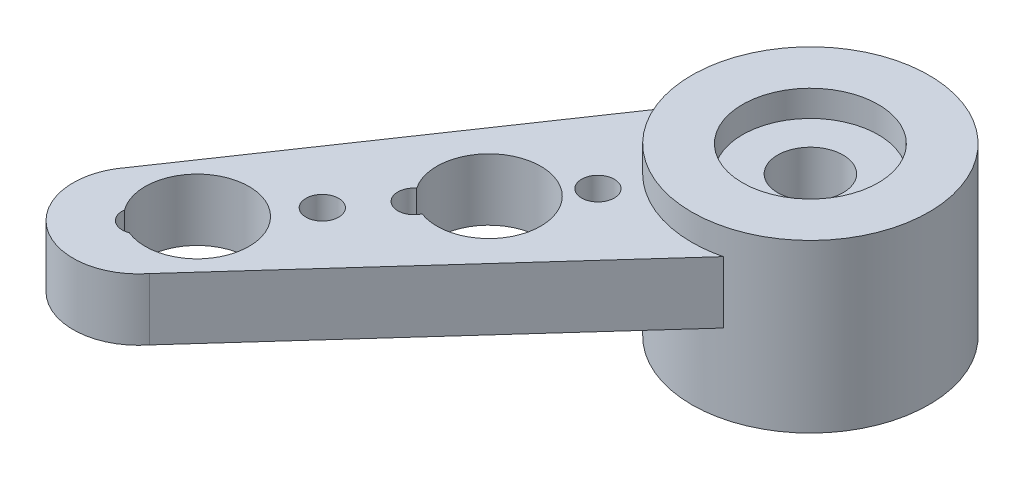
from build123d import *

# Parameters (mm, degrees)
SKETCH1_R           = 3.625
SKETCH1_R_2         = 2.075
BOSS_EXTRUDE1_DEPTH = 2.41
SKETCH2_R           = 1
SKETCH2_R_2         = 0.5
BOSS_EXTRUDE3_DEPTH = 1.89
BOSS_EXTRUDE4_START = 4.3
SKETCH1_2_R         = 3.625
SKETCH1_2_R_2       = 2.075
BOSS_EXTRUDE4_DEPTH = 0.8
SKETCH3_R           = 1.5875
CUT_EXTRUDE1_DEPTH  = 18.958844524


with BuildPart() as part:
    # Sketch1 → Boss-Extrude1 (new body)
    with BuildSketch(Plane(origin=(0, 0, 0), x_dir=(1, 0, 0), z_dir=(0, 1, 0))):
        with Locations(Location((0, 0, 0), (0, 0, 270))):
            Circle(SKETCH1_R)
        with Locations(Location((0, 0, 0), (0, 0, 270))):
            Circle(SKETCH1_R_2, mode=Mode.SUBTRACT)
    extrude(amount=BOSS_EXTRUDE1_DEPTH)

    # Sketch2 → Boss-Extrude3 (add)
    with BuildSketch(Plane(origin=(0, 2.41, 0), x_dir=(1, 0, 0), z_dir=(0, 1, 0))):
        with BuildLine():
            Line((-10.6054557, -10.267177528), (-3.625, 0))
            ThreePointArc((-3.625, 0), (2.238819707, 2.851019347), (0.859585555, -3.521610097))
            Line((0.859585555, -3.521610097), (-7.459503317, -12.737599274))
            ThreePointArc((-7.459503317, -12.737599274), (-10.267690381, -13.075364593), (-10.6054557, -10.267177528))
        make_face()
        with Locations(Location((0, 0, 0), (0, 0, 270))):
            Circle(SKETCH2_R, mode=Mode.SUBTRACT)
        with Locations(Location((-9.032479508, -11.502388401, 0), (0, 0, 270))):
            Circle(SKETCH2_R_2, mode=Mode.SUBTRACT)
        with Locations(Location((-7.797268635, -9.92941221, 0), (0, 0, 270))):
            Circle(SKETCH2_R_2, mode=Mode.SUBTRACT)
        with Locations(Location((-6.562057762, -8.356436018, 0), (0, 0, 270))):
            Circle(SKETCH2_R_2, mode=Mode.SUBTRACT)
        with Locations(Location((-5.32684689, -6.783459826, 0), (0, 0, 270))):
            Circle(SKETCH2_R_2, mode=Mode.SUBTRACT)
        with Locations(Location((-4.091636017, -5.210483635, 0), (0, 0, 270))):
            Circle(SKETCH2_R_2, mode=Mode.SUBTRACT)
        with Locations(Location((-2.856425144, -3.637507443, 0), (0, 0, 270))):
            Circle(SKETCH2_R_2, mode=Mode.SUBTRACT)
    extrude(amount=BOSS_EXTRUDE3_DEPTH)

    # Sketch1<2> → Boss-Extrude4 (add)
    with BuildSketch(Plane(origin=(0, 0, 0), x_dir=(1, 0, 0), z_dir=(0, 1, 0)).offset(BOSS_EXTRUDE4_START)):
        with Locations(Location((0, 0, 0), (0, 0, 270))):
            Circle(SKETCH1_2_R)
        with Locations(Location((0, 0, 0), (0, 0, 270))):
            Circle(SKETCH1_2_R_2, mode=Mode.SUBTRACT)
    extrude(amount=BOSS_EXTRUDE4_DEPTH)

    # Sketch3 → Cut-Extrude1 (cut, through all)
    with BuildSketch(Plane(origin=(0, 4.3, 0), x_dir=(1, 0, 0), z_dir=(0, 1, 0))):
        with Locations((-8.245032577, -10.499616079)):
            Circle(SKETCH3_R)
        with Locations((-4.323238055, -5.505416671)):
            Circle(SKETCH3_R)
    extrude(amount=-CUT_EXTRUDE1_DEPTH, mode=Mode.SUBTRACT)


solid = part.part
